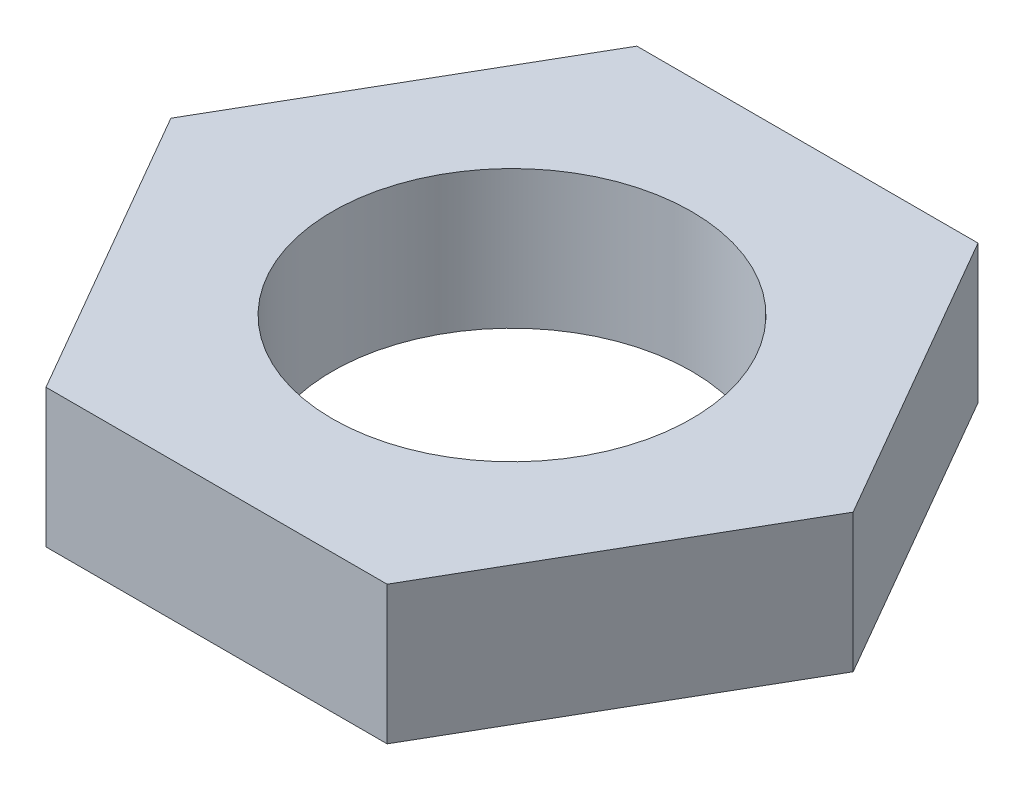
from build123d import *

# Parameters (mm, degrees)
SKETCH1_R           = 3
BOSS_EXTRUDE1_DEPTH = 2.31


with BuildPart() as part:
    # Sketch1 → Boss-Extrude1 (new body)
    with BuildSketch(Plane(origin=(0, 0, 0), x_dir=(1, 0, 0), z_dir=(0, 1, 0))):
        Polygon((-2.849223578, -4.935), (2.849223578, -4.935), (5.698447157, 0), (2.849223578, 4.935), (-2.849223578, 4.935), (-5.698447157, 0), align=None)
        with Locations(Location((0, 0, 0), (0, 0, 270))):
            Circle(SKETCH1_R, mode=Mode.SUBTRACT)
    extrude(amount=BOSS_EXTRUDE1_DEPTH)


solid = part.part
